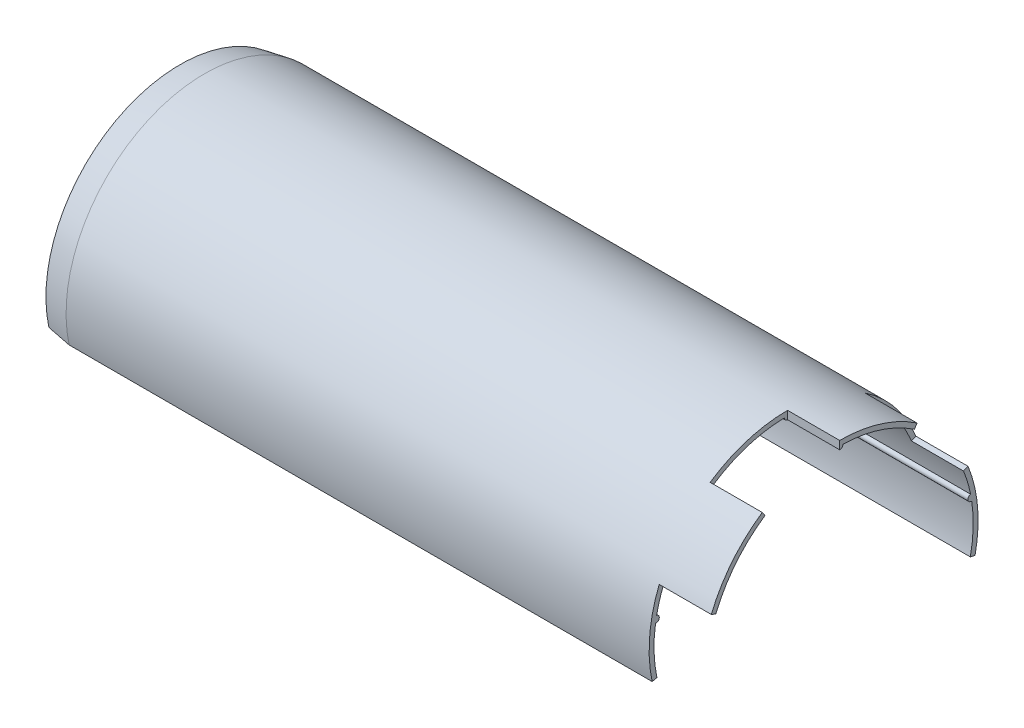
from build123d import *

# Parameters (mm, degrees)
CUT_EXTRUDE4_REACH              = 555.223
CUT_EXTRUDE1_DEPTH              = 5
BOSS_EXTRUDE1_REACH             = 555.223
SKETCH10_R                      = 2
CIRPATTERN1_COUNT               = 2
CIRPATTERN1_ANGLE               = 80
CIRPATTERN1_THE_OTHER_WAY_COUNT = 2
CIRPATTERN1_THE_OTHER_WAY_ANGLE = 80
F_2_0MM_DOWEL_HOLE1_D           = 2
F_2_0MM_DOWEL_HOLE1_ON_FACE_2_D = 2
F_2_0MM_DOWEL_HOLE1_ON_FACE_3_D = 2
F_2_0MM_DOWEL_HOLE1_ON_FACE_4_D = 2
CUT_EXTRUDE5_START              = -32
CUT_EXTRUDE5_DEPTH              = 32
CIRPATTERN2_COUNT               = 3
CIRPATTERN2_ANGLE               = 136
SKETCH19_R                      = 118.982211047
CUT_EXTRUDE6_DEPTH              = 180


with BuildPart() as part:
    # Sketch1 → Revolve5 (revolve)
    with BuildSketch(Plane.XY, mode=Mode.PRIVATE) as revolve5_sk:
        with BuildLine():
            Line((540, 85), (150, 85))
            add(Edge.make_bspline(
                [(0, 0), (-0.012294225, 3.891554312), (-0.027437579, 8.684958126), (0.361573767, 14.085722357), (0.576098453, 16.090496183), (0.782493435, 17.604822189), (0.986227589, 18.854298664), (1.188670863, 19.931536976), (1.390404268, 20.885679324), (1.591698837, 21.746529091), (1.792703864, 22.533746067), (1.993507167, 23.261083862), (2.253808552, 24.139979457), (2.580573656, 25.146175179), (2.983585386, 26.259501153), (3.385879093, 27.271261727), (3.787683439, 28.201566994), (4.189138614, 29.064817448), (4.590335615, 29.871726974), (5.05331092, 30.74778076), (5.583218589, 31.683457084), (6.185429632, 32.669732492), (6.787226927, 33.590624245), (7.451481511, 34.546094958), (8.182770444, 35.530963646), (8.985083876, 36.540013411), (9.850344603, 37.562485558), (10.782608842, 38.595746542), (11.785011743, 39.636928062), (12.851029789, 40.680352273), (13.983960321, 41.72463117), (15.186170623, 42.768194245), (16.387975322, 43.755294725), (17.654380903, 44.743506811), (18.987602276, 45.731471932), (20.389198856, 46.717890971), (21.790522044, 47.657861765), (23.257103599, 48.59836715), (24.790441056, 49.538186318), (26.391587757, 50.476245251), (28.05829275, 51.412163763), (29.791720393, 52.345056651), (31.59268286, 53.274185034), (33.459445798, 54.199628429), (35.392909821, 55.120726442), (37.459746918, 56.067201212), (39.59327023, 57.006562681), (41.860151348, 57.96659169), (44.193707143, 58.917521836), (46.660609333, 59.885320784), (49.260404933, 60.867669295), (51.99403381, 61.861671206), (54.860992187, 62.865616104), (57.794602823, 63.85555089), (60.861539281, 64.853573463), (64.06149587, 65.858380358), (67.461497598, 66.888166734), (70.995135905, 67.920234745), (74.662088876, 68.953918346), (78.462130407, 69.988575944), (82.462197069, 71.040436012), (86.662284614, 72.107100186), (91.062388571, 73.18640193), (95.662505252, 74.276388609), (100.462631288, 75.375305679), (105.462763855, 76.481579791), (110.662900527, 77.593803027), (116.063039296, 78.710717608), (121.663178505, 79.831201671), (127.529872228, 80.967142806), (133.663251007, 82.116215238), (140.063409966, 83.276352633), (145.198462089, 84.177415336), (148.333178957, 84.715838785), (149.39998937, 84.897876633), (149.733326587, 84.954653305), (149.933332963, 84.98866355), (150, 85)],
                knots=[0, 0, 0, 0, 0.061462209, 0.075705788, 0.085548437, 0.093321935, 0.099856333, 0.105553797, 0.110642995, 0.115267654, 0.119524592, 0.123482434, 0.127191759, 0.134010181, 0.140199136, 0.145901384, 0.151215493, 0.156212588, 0.160945789, 0.165455878, 0.171870938, 0.177937368, 0.183716425, 0.189254732, 0.196326298, 0.203099892, 0.209625632, 0.217492532, 0.225090541, 0.232464167, 0.24106462, 0.249438142, 0.257620809, 0.265641058, 0.274822876, 0.28384341, 0.292725747, 0.301488561, 0.311376345, 0.321146599, 0.330814589, 0.341584449, 0.352255608, 0.362840299, 0.374512001, 0.386101174, 0.398765505, 0.411352526, 0.425006218, 0.438588433, 0.453231339, 0.468927603, 0.484557057, 0.501237456, 0.517857889, 0.535527769, 0.554243231, 0.574001115, 0.593705628, 0.614453399, 0.636242373, 0.65907093, 0.682937829, 0.707842151, 0.733783254, 0.760760729, 0.78877436, 0.81782409, 0.847909993, 0.879032247, 0.912262482, 0.946527454, 0.981827786, 0.994656092, 0.99679374, 0.998931275, 1, 1, 1, 1], degree=3))
            Line((0, 0), (2.999985029, 0))
            Line((2.999985029, 0), (2.999985029, 0.009477573))
            add(Edge.make_bspline(
                [(2.999985029, 0.009477573), (2.993793366, 1.969356524), (2.981962234, 5.911210338), (3.144727077, 11.691517384), (3.670861531, 17.326178467), (4.819198941, 22.729714595), (6.752012755, 27.815986079), (10.434016108, 34.068947754), (16.885973109, 40.769818613), (26.31149284, 47.219276633), (36.588463571, 52.532925143), (47.339293153, 57.041613966), (62.05269101, 62.270744564), (80.889819608, 67.717439736), (103.802651174, 73.170901437), (119.646381092, 76.401254352), (128.250826275, 78.04455103), (129.150186585, 78.215050111), (129.599928532, 78.3)],
                knots=[0, 0, 0, 0, 0.031208253, 0.062416506, 0.093624758, 0.124833011, 0.156041264, 0.187249517, 0.249666023, 0.312082528, 0.374499034, 0.43691554, 0.499332045, 0.624165056, 0.748998068, 0.873333508, 0.88058804, 0.887842573, 0.887842573, 0.887842573, 0.887842573], degree=3))
            add(Edge.make_bspline(
                [(129.599928532, 78.3), (130.04967048, 78.384949889), (130.94927796, 78.554250366), (132.299119739, 78.806440107), (133.649347026, 79.056894297), (134.549738344, 79.222723073), (135, 79.305358628)],
                knots=[0.887842573, 0.887842573, 0.887842573, 0.887842573, 0.895097105, 0.902351638, 0.90960617, 0.916860703, 0.916860703, 0.916860703, 0.916860703], degree=3))
            add(Edge.make_bspline(
                [(135, 79.305358628), (135.450261656, 79.387994183), (140.528235702, 80.316663108), (145.615370758, 81.210683778), (150.253322265, 82)],
                knots=[0.916860703, 0.916860703, 0.916860703, 0.916860703, 0.924115235, 0.99866409, 0.99866409, 0.99866409, 0.99866409], degree=3))
            Line((150.253322265, 82), (540, 82))
            Line((540, 82), (540, 85))
        make_face()
        with BuildLine():
            Line((135, 78.3), (135, 79.305358628))
            add(Edge.make_bspline(
                [(129.599928532, 78.3), (130.04967048, 78.384949889), (130.94927796, 78.554250366), (132.299119739, 78.806440107), (133.649347026, 79.056894297), (134.549738344, 79.222723073), (135, 79.305358628)],
                knots=[0.887842573, 0.887842573, 0.887842573, 0.887842573, 0.895097105, 0.902351638, 0.90960617, 0.916860703, 0.916860703, 0.916860703, 0.916860703], degree=3))
            Line((129.599928532, 78.3), (135, 78.3))
        make_face()
    revolve(revolve5_sk.sketch.rotate(Axis((2.999985029, 0, 0), (1, 0, 0)), 90), axis=Axis((2.999985029, 0, 0), (1, 0, 0)))

    # Cut-Extrude4: up to this face of the body (flat: up to its plane)
    cut_extrude4_end = Plane(part.part.faces().sort_by_distance((135, 0, -78.524309427))[0])
    # Sketch12 → Cut-Extrude4 (cut, up to the picked face)
    with BuildSketch(Plane(origin=(540, 0, 0), x_dir=(0, 0, -1), z_dir=(1, 0, 0)), mode=Mode.PRIVATE) as cut_extrude4_sk1:
        with BuildLine():
            Line((0, 0), (-83.142546062, -17.67249372))
            ThreePointArc((-83.142546062, -17.67249372), (0, -85), (83.142546062, -17.67249372))
            Line((83.142546062, -17.67249372), (0, 0))
        make_face()
    cut_extrude4_tool1 = split(extrude(cut_extrude4_sk1.sketch, amount=-CUT_EXTRUDE4_REACH, mode=Mode.PRIVATE), bisect_by=cut_extrude4_end, keep=Keep.BOTH, mode=Mode.PRIVATE)
    add(cut_extrude4_tool1.solids().sort_by(Axis((540, -40.71553, 0), (-1, 0, 0)))[0], mode=Mode.SUBTRACT)

    # Sketch4 → Cut-Extrude1 (cut)
    with BuildSketch(Plane(origin=(135, 0, 0), x_dir=(0, 0, -1), z_dir=(1, 0, 0))):
        with BuildLine():
            ThreePointArc((40.257565708, -71.845165599), (66.314386739, -48.834429741), (80.55566273, -17.122634693))
            Line((80.55566273, -17.122634693), (77.572346267, -16.488511203))
            Line((77.572346267, -16.488511203), (76.588957137, -16.279485391))
            ThreePointArc((76.588957137, -16.279485391), (64.593537692, -44.255676341), (42.836139649, -65.543536218))
            ThreePointArc((42.836139649, -65.543536218), (41.586655777, -68.710638003), (40.257565708, -71.845165599))
        make_face()
    extrude(amount=-CUT_EXTRUDE1_DEPTH, mode=Mode.SUBTRACT)

    # Sketch10 → Boss-Extrude1 (add, up to next)
    with BuildSketch(Plane(origin=(540, 0, 0), x_dir=(0, 0, -1), z_dir=(1, 0, 0)), mode=Mode.PRIVATE) as boss_extrude1_sk1:
        with Locations((0, 82)):
            Circle(SKETCH10_R)
    boss_extrude1_tool1 = extrude(boss_extrude1_sk1.sketch, amount=-BOSS_EXTRUDE1_REACH, mode=Mode.PRIVATE) - part.part
    boss_extrude1 = boss_extrude1_tool1.solids().sort_by_distance((540, 82, 0))[0]
    add(boss_extrude1)

    # CirPattern1: Boss-Extrude1 ×2 about axis
    cirpattern1_axis = Axis((2.999985029, 0, 0), (-1, 0, 0))
    for i in range(1, CIRPATTERN1_COUNT):
        add(boss_extrude1.rotate(cirpattern1_axis, i * CIRPATTERN1_ANGLE / (CIRPATTERN1_COUNT - 1)))

    # CirPattern1 the other way: Boss-Extrude1 ×2 about axis
    cirpattern1_the_other_way_axis = Axis((2.999985029, 0, 0), (1, 0, 0))
    for i in range(1, CIRPATTERN1_THE_OTHER_WAY_COUNT):
        add(boss_extrude1.rotate(cirpattern1_the_other_way_axis, i * CIRPATTERN1_THE_OTHER_WAY_ANGLE / (CIRPATTERN1_THE_OTHER_WAY_COUNT - 1)))

    # Ø2.0mm Dowel Hole1 (through all)
    with Locations(Plane(origin=(132.5, -78.3, 0), x_dir=(0, 0, 1), z_dir=(0, 1, 0))):
        with Locations((0, 0)):
            Hole(F_2_0MM_DOWEL_HOLE1_D / 2)

    # Ø2.0mm Dowel Hole1 on face 2 (through all)
    with Locations(Plane(origin=(132.5, 0, 78.3), x_dir=(-1, 0, 0), z_dir=(0, 0, -1))):
        with Locations((0, 0)):
            Hole(F_2_0MM_DOWEL_HOLE1_ON_FACE_2_D / 2)

    # Ø2.0mm Dowel Hole1 on face 3 (through all)
    with Locations(Plane(origin=(132.5, 78.3, 0), x_dir=(0, 0, -1), z_dir=(0, -1, 0))):
        with Locations((0, 0)):
            Hole(F_2_0MM_DOWEL_HOLE1_ON_FACE_3_D / 2)

    # Ø2.0mm Dowel Hole1 on face 4 (through all)
    with Locations(Plane(origin=(132.5, 0, -78.3), x_dir=(1, 0, 0), z_dir=(0, 0, 1))):
        with Locations((0, 0)):
            Hole(F_2_0MM_DOWEL_HOLE1_ON_FACE_4_D / 2)

    # Sketch18 → Cut-Extrude5 (cut)
    with BuildSketch(Plane(origin=(540, 0, 0), x_dir=(0, 0, -1), z_dir=(1, 0, 0)).offset(CUT_EXTRUDE5_START)):
        with BuildLine():
            Line((-80.20810326, -17.048758647), (-83.142546062, -17.67249372))
            ThreePointArc((-83.142546062, -17.67249372), (-84.676549338, 7.408238134), (-78.810627638, 31.84156044))
            Line((-78.810627638, 31.84156044), (-76.029076074, 30.71774066))
            Line((-76.029076074, 30.71774066), (0, 0))
            Line((0, 0), (-80.20810326, -17.048758647))
        make_face()
    cut_extrude5 = extrude(amount=CUT_EXTRUDE5_DEPTH, mode=Mode.SUBTRACT)

    # CirPattern2: Cut-Extrude5 ×3 about axis
    cirpattern2_axis = Axis((0, 0, 0), (-1, 0, 0))
    for i in range(1, CIRPATTERN2_COUNT):
        add(cut_extrude5.rotate(cirpattern2_axis, i * CIRPATTERN2_ANGLE / (CIRPATTERN2_COUNT - 1)), mode=Mode.SUBTRACT)

    # Sketch19 → Cut-Extrude6 (cut)
    with BuildSketch(Plane(origin=(135, 0, 0), x_dir=(0, 0, -1), z_dir=(1, 0, 0))):
        Circle(SKETCH19_R)
    extrude(amount=-CUT_EXTRUDE6_DEPTH, mode=Mode.SUBTRACT)


solid = part.part
